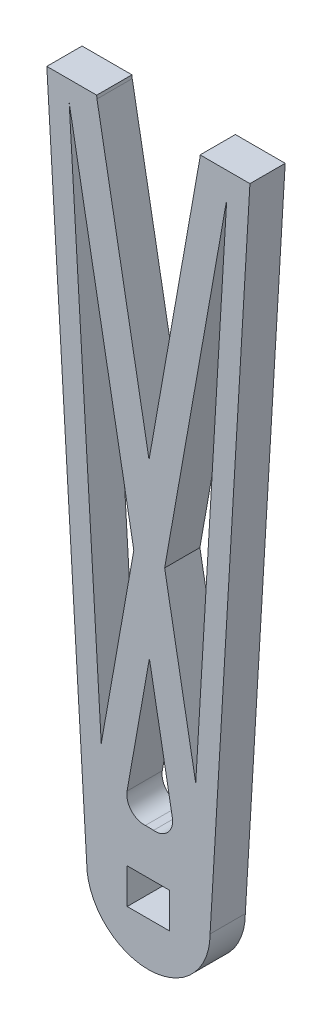
from build123d import *

# Parameters (mm, degrees)
SKETCH1_R           = 3
BOSS_EXTRUDE2_DEPTH = 10
FILLET1_R           = 20
FILLET2_R           = 20
CUT_EXTRUDE1_START  = -10
CUT_EXTRUDE1_DEPTH  = 10
FILLET3_R           = 5
CUT_EXTRUDE6_DEPTH  = 10
SKETCH7_W           = 65.010384479
SKETCH7_H           = 38.033760717
CUT_EXTRUDE7_DEPTH  = 10


with BuildPart() as part:
    # Sketch1 → Boss-Extrude2 (new body)
    with BuildSketch(Plane.XY):
        with BuildLine():
            Line((-30, 15.770412854), (-30, 0))
            Line((-30, 0), (-17.5, -210))
            ThreePointArc((-17.5, -210), (0, -227.5), (17.5, -210))
            Line((17.5, -210), (30, 0))
            Line((30, 0), (30, 15.770412854))
            Line((30, 15.770412854), (-30, 15.770412854))
        make_face()
        with Locations((-15, 0)):
            Circle(SKETCH1_R, mode=Mode.SUBTRACT)
        with Locations((15, 0)):
            Circle(SKETCH1_R, mode=Mode.SUBTRACT)
        Polygon((0, -205), (6, -205), (6, -215), (-6, -215), (-6, -205), align=None, mode=Mode.SUBTRACT)
    extrude(amount=BOSS_EXTRUDE2_DEPTH)

    # Fillet1
    fillet1_edges = [part.edges().sort_by_distance(p)[0] for p in [
        (-30, 15.770412854, 5),
    ]]
    fillet(fillet1_edges, radius=FILLET1_R)

    # Fillet2
    fillet2_edges = [part.edges().sort_by_distance(p)[0] for p in [
        (30, 15.770412854, 5),
    ]]
    fillet(fillet2_edges, radius=FILLET2_R)

    # Sketch4 → Cut-Extrude1 (cut)
    with BuildSketch(Plane.XY.offset(10).offset(CUT_EXTRUDE1_START)):
        Polygon((-15.651797422, -15), (0.190220551, -102.160979768), (15.643622882, -15), (15, -15), align=None)
        Polygon((-22.473027071, -25.6531452), (-13.367328465, -178.628881795), (-4.134156204, -126.551525408), align=None)
        Polygon((22.230419841, -27.161313899), (4.615986353, -126.511039477), (13.430162671, -175.005634359), align=None)
        with BuildLine():
            Line((0.291609598, -150.901585116), (-7.372445375, -194.128735111))
            ThreePointArc((-7.372445375, -194.128735111), (0.476576628, -192.506490497), (8.225632191, -194.553674383))
            Line((8.225632191, -194.553674383), (0.291609598, -150.901585116))
        make_face()
    extrude(amount=CUT_EXTRUDE1_DEPTH, mode=Mode.SUBTRACT)

    # Fillet3
    fillet3_edges = [part.edges().sort_by_distance(p)[0] for p in [
        (8.225632191, -194.553674383, 5),
        (-7.372445375, -194.128735111, 5),
        (-15.651797422, -15, 5),
        (15.643622882, -15, 5),
    ]]
    fillet(fillet3_edges, radius=FILLET3_R)

    # Sketch5 → Cut-Extrude6 (cut)
    with BuildSketch(Plane.XY.offset(10)):
        with BuildLine():
            Line((29.260488635, 0), (20, 0))
            Line((20, 0), (20, -20))
            Line((20, -20), (28.80952381, -20))
            Line((28.80952381, -20), (29.677502384, -5.417959945))
            ThreePointArc((29.677502384, -5.417959945), (29.653859351, -2.694751229), (29.260488635, 0))
        make_face()
        with BuildLine():
            Line((20, 12.921923742), (20, 0))
            Line((20, 0), (29.260488635, 0))
            ThreePointArc((29.260488635, 0), (25.96931496, 7.420606017), (20, 12.921923742))
        make_face()
    extrude(amount=-CUT_EXTRUDE6_DEPTH, mode=Mode.SUBTRACT)

    # Sketch7 → Cut-Extrude7 (cut)
    with BuildSketch(Plane.XY.offset(10)):
        with Locations((-3.695668429, -0.983119642)):
            Rectangle(SKETCH7_W, SKETCH7_H)
    extrude(amount=-CUT_EXTRUDE7_DEPTH, mode=Mode.SUBTRACT)


solid = part.part
